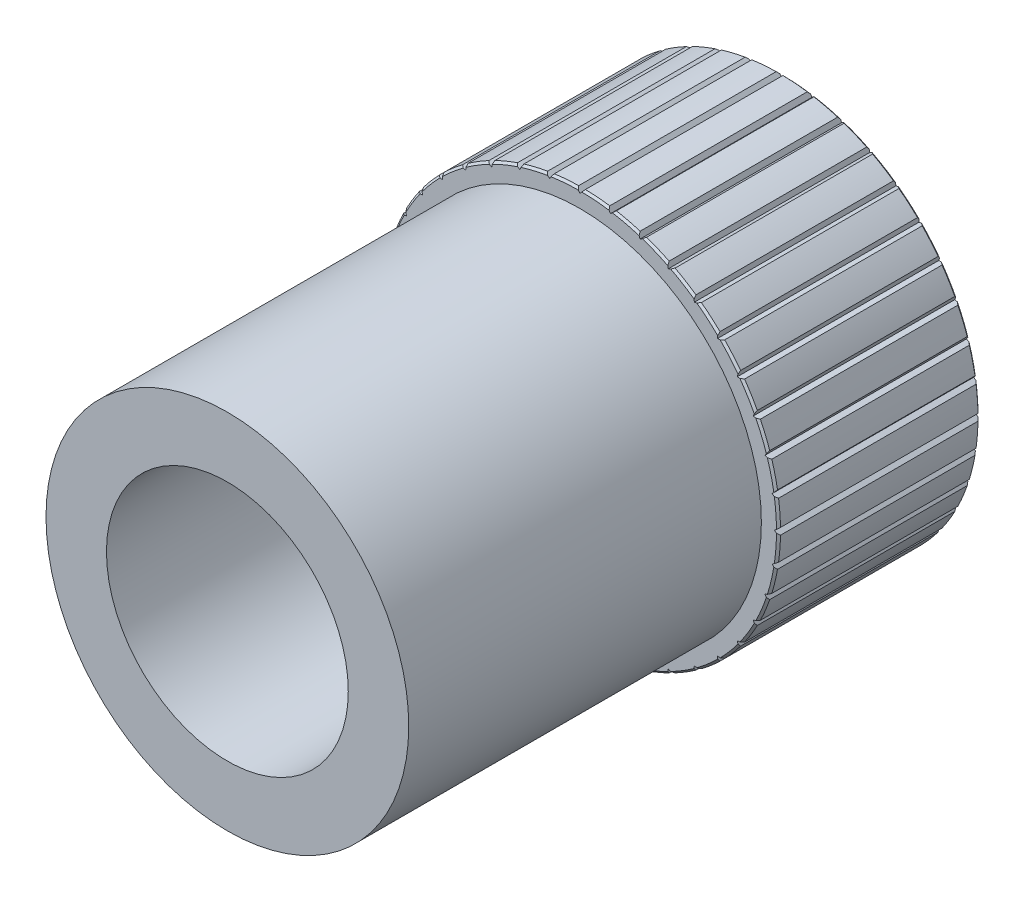
from build123d import *

# Parameters (mm, degrees)
SKETCH1_R           = 9
SKETCH1_R_2         = 6
BOSS_EXTRUDE1_DEPTH = 27.5
SKETCH1_3_R         = 9.85
SKETCH1_3_R_2       = 9
BOSS_EXTRUDE2_DEPTH = 10
SKETCH2_R           = 7.5
SKETCH2_R_2         = 6
CUT_EXTRUDE1_DEPTH  = 7.5
CUT_EXTRUDE2_START  = -10
CUT_EXTRUDE2_DEPTH  = 10
CHAMFER1_SIZE       = 0.1
CIRPATTERN1_COUNT   = 40


with BuildPart() as part:
    # Sketch1 → Boss-Extrude1 (new body)
    with BuildSketch(Plane.XY):
        Circle(SKETCH1_R)
        Circle(SKETCH1_R_2, mode=Mode.SUBTRACT)
    extrude(amount=BOSS_EXTRUDE1_DEPTH)

    # Sketch1<3> → Boss-Extrude2 (add)
    with BuildSketch(Plane.XY):
        Circle(SKETCH1_3_R)
        Circle(SKETCH1_3_R_2, mode=Mode.SUBTRACT)
    extrude(amount=BOSS_EXTRUDE2_DEPTH)

    # Sketch2 → Cut-Extrude1 (cut)
    with BuildSketch(Plane(origin=(0, 0, 0), x_dir=(-1, 0, 0), z_dir=(0, 0, -1))):
        Circle(SKETCH2_R)
        Circle(SKETCH2_R_2, mode=Mode.SUBTRACT)
    extrude(amount=-CUT_EXTRUDE1_DEPTH, mode=Mode.SUBTRACT)

    # Sketch2<3> → Cut-Extrude2 (cut)
    with BuildSketch(Plane(origin=(0, 0, 0), x_dir=(-1, 0, 0), z_dir=(0, 0, -1)).offset(CUT_EXTRUDE2_START)):
        Polygon((-0.839099631, 10.65), (0.839099631, 10.65), (0, 9.65), align=None)
    cut_extrude2 = extrude(amount=CUT_EXTRUDE2_DEPTH, mode=Mode.SUBTRACT)

    # Chamfer1
    chamfer1_edges = [part.edges().sort_by_distance(p)[0] for p in [
        (-6.90583538, -7.023669818, 10),
        (-6.90583538, -7.023669818, 0),
    ]]
    chamfer(chamfer1_edges, length=CHAMFER1_SIZE)

    # CirPattern1: Cut-Extrude2 ×40 about axis
    cirpattern1_axis = Axis((0, 0, 0), (0, 0, 1))
    for i in range(1, CIRPATTERN1_COUNT):
        add(cut_extrude2.rotate(cirpattern1_axis, i * 360 / CIRPATTERN1_COUNT), mode=Mode.SUBTRACT)


solid = part.part
